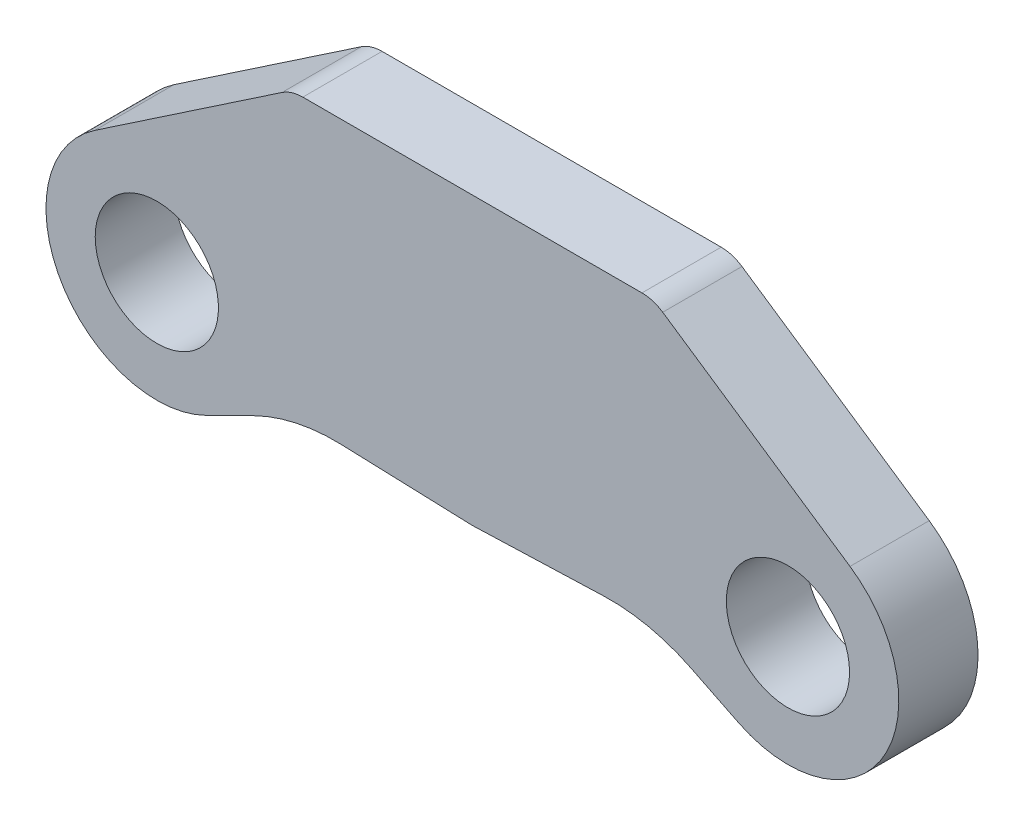
from build123d import *

# Parameters (mm, degrees)
SKETCH1_R           = 7.775663032
BOSS_EXTRUDE1_DEPTH = 10


with BuildPart() as part:
    # Sketch1 → Boss-Extrude1 (new body)
    with BuildSketch(Plane.XY):
        with BuildLine():
            Line((0, 19.052140157), (21.399532491, 19.052140157))
            ThreePointArc((21.399532491, 19.052140157), (22.771528747, 18.846885641), (24.023387185, 18.249095047))
            Line((24.023387185, 18.249095047), (47.657624277, 2.287166265))
            ThreePointArc((47.657624277, 2.287166265), (51.92269033, -16.338565843), (33.626657752, -21.848908566))
            Line((33.626657752, -21.848908566), (27.605393149, -18.872072273))
            ThreePointArc((27.605393149, -18.872072273), (22.228507675, -16.996447441), (16.556211898, -16.492536209))
            Line((16.556211898, -16.492536209), (0, -17.070741143))
            Line((0, -17.070741143), (0, 0))
            Line((0, 0), (0, 19.052140157))
        make_face()
        with Locations((39.827165888, -9.307103614)):
            Circle(SKETCH1_R, mode=Mode.SUBTRACT)
    boss_extrude1 = extrude(amount=BOSS_EXTRUDE1_DEPTH)

    # Mirror1: Boss-Extrude1 across plane
    add(boss_extrude1.mirror(Plane(origin=(0, 0, 10), x_dir=(0, 0, 1), z_dir=(1, 0, 0))))


solid = part.part
